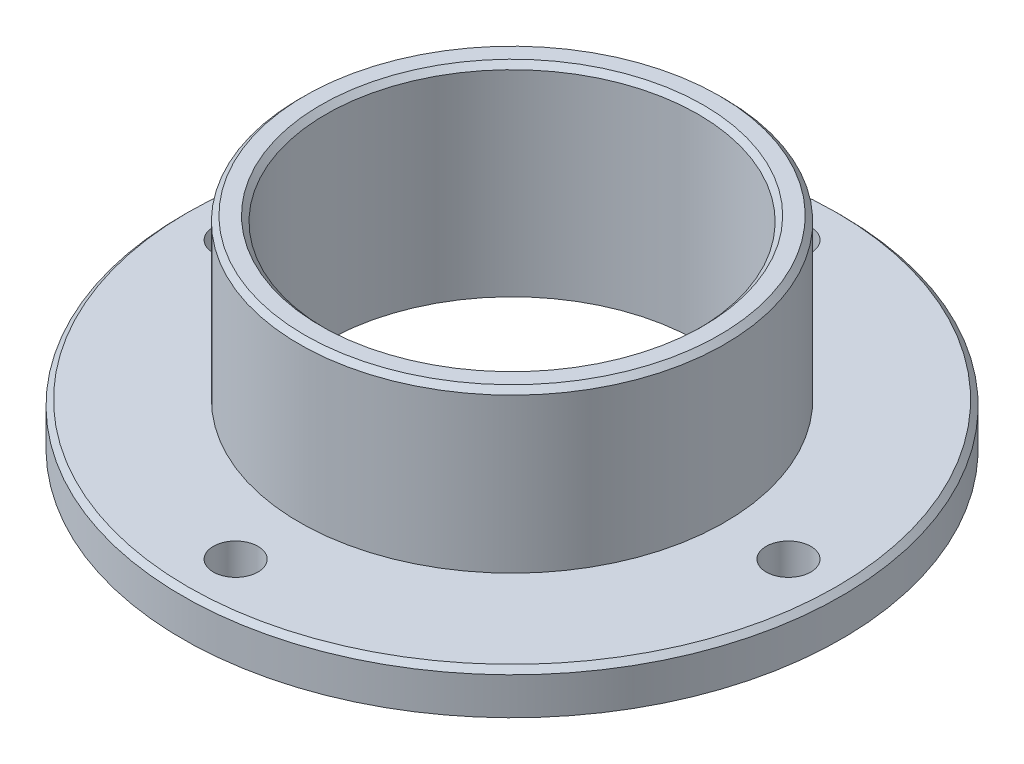
from build123d import *

# Parameters (mm, degrees)
TAP_DRILL_FOR_M5_TAP1_D = 4.2
CIRPATTERN1_COUNT       = 4
CHAMFER1_SIZE           = 0.5
CHAMFER2_SIZE           = 0.5


with BuildPart() as part:
    # Sketch1 → Revolve1 (revolve)
    with BuildSketch(Plane.XY, mode=Mode.PRIVATE) as revolve1_sk:
        Polygon((-31, 0), (-17.5, 0), (-17.5, 19), (-20, 19), (-20, 4), (-31, 4), align=None)
    revolve(revolve1_sk.sketch.rotate(Axis((0, 0, 0), (0, 1, 0)), 270), axis=Axis((0, 0, 0), (0, 1, 0)))

    # Tap Drill for M5 Tap1 (through all)
    with Locations(Plane(origin=(0, 4, 0), x_dir=(1, 0, 0), z_dir=(0, 1, 0))):
        with Locations((0, 26)):
            tap_drill_for_m5_tap1 = Hole(TAP_DRILL_FOR_M5_TAP1_D / 2)

    # CirPattern1: Tap Drill for M5 Tap1 ×4 about axis
    cirpattern1_axis = Axis((0, 0, 0), (0, 1, 0))
    for i in range(1, CIRPATTERN1_COUNT):
        add(tap_drill_for_m5_tap1.rotate(cirpattern1_axis, i * 360 / CIRPATTERN1_COUNT), mode=Mode.SUBTRACT)

    # Chamfer1
    chamfer1_edges = [part.edges().sort_by_distance(p)[0] for p in [
        (0, 19, 20),
        (0, 19, 17.5),
    ]]
    chamfer(chamfer1_edges, length=CHAMFER1_SIZE)

    # Chamfer2
    chamfer2_edges = [part.edges().sort_by_distance(p)[0] for p in [
        (0, 4, 31),
    ]]
    chamfer(chamfer2_edges, length=CHAMFER2_SIZE)


solid = part.part
